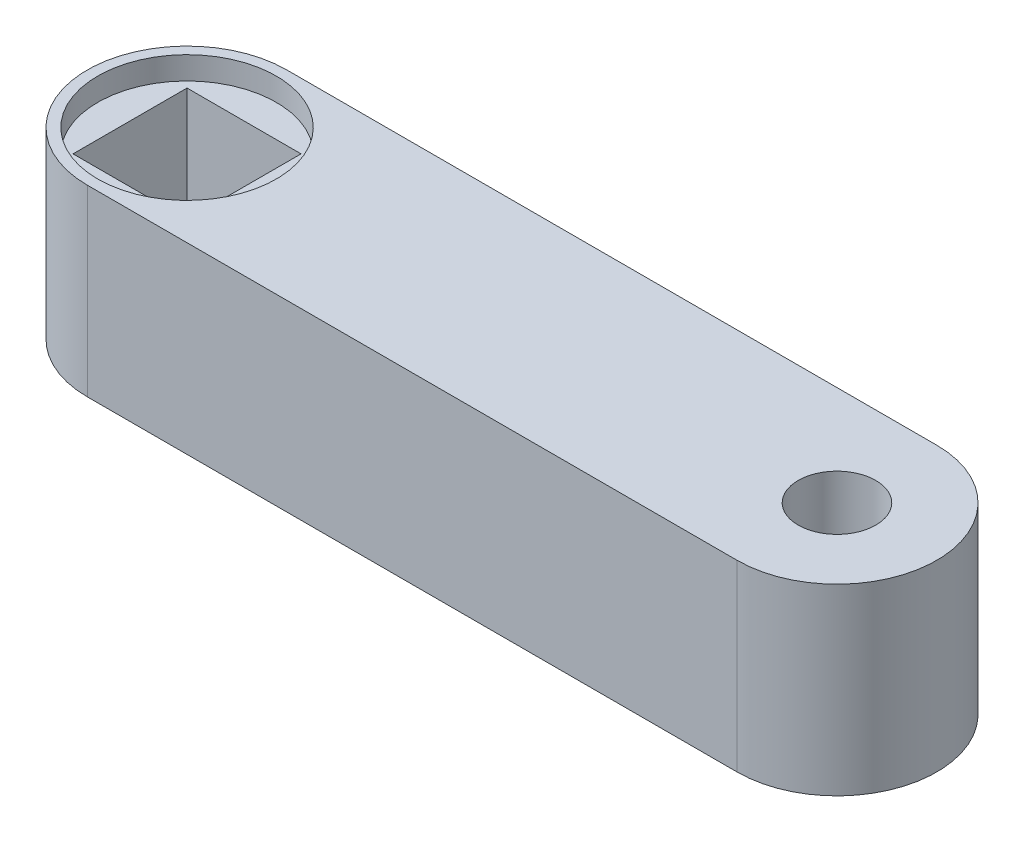
from build123d import *

# Parameters (mm, degrees)
BOSS_EXTRUDE1_DEPTH = 10.2108
SKETCH2_R           = 2.159
SKETCH2_W           = 6.35
SKETCH2_H           = 6.35
CUT_EXTRUDE1_DEPTH  = 44.339349641
SKETCH3_R           = 4.97205
CUT_EXTRUDE2_DEPTH  = 1.27


with BuildPart() as part:
    # Sketch1 → Boss-Extrude1 (new body)
    with BuildSketch(Plane(origin=(0, 0, 0), x_dir=(1, 0, 0), z_dir=(0, 1, 0))):
        with BuildLine():
            Line((0, 5.55625), (36.195, 5.55625))
            ThreePointArc((36.195, 5.55625), (41.75125, 0), (36.195, -5.55625))
            Line((36.195, -5.55625), (0, -5.55625))
            ThreePointArc((0, -5.55625), (-5.55625, 0), (0, 5.55625))
        make_face()
    extrude(amount=BOSS_EXTRUDE1_DEPTH)

    # Sketch2 → Cut-Extrude1 (cut, through all)
    with BuildSketch(Plane(origin=(0, 10.2108, 0), x_dir=(1, 0, 0), z_dir=(0, 1, 0))):
        with Locations(Location((36.195, 0, 0), (0, 0, 270))):
            Circle(SKETCH2_R)
        Rectangle(SKETCH2_W, SKETCH2_H)
    extrude(amount=-CUT_EXTRUDE1_DEPTH, mode=Mode.SUBTRACT)

    # Sketch3 → Cut-Extrude2 (cut)
    with BuildSketch(Plane(origin=(0, 10.2108, 0), x_dir=(1, 0, 0), z_dir=(0, 1, 0))):
        with Locations(Location((0, 0, 0), (0, 0, 270))):
            Circle(SKETCH3_R)
    cut_extrude2 = extrude(amount=-CUT_EXTRUDE2_DEPTH, mode=Mode.SUBTRACT)

    # Mirror1: Cut-Extrude2 across plane
    add(cut_extrude2.mirror(Plane.ZX.offset(5.1054)), mode=Mode.SUBTRACT)


solid = part.part
